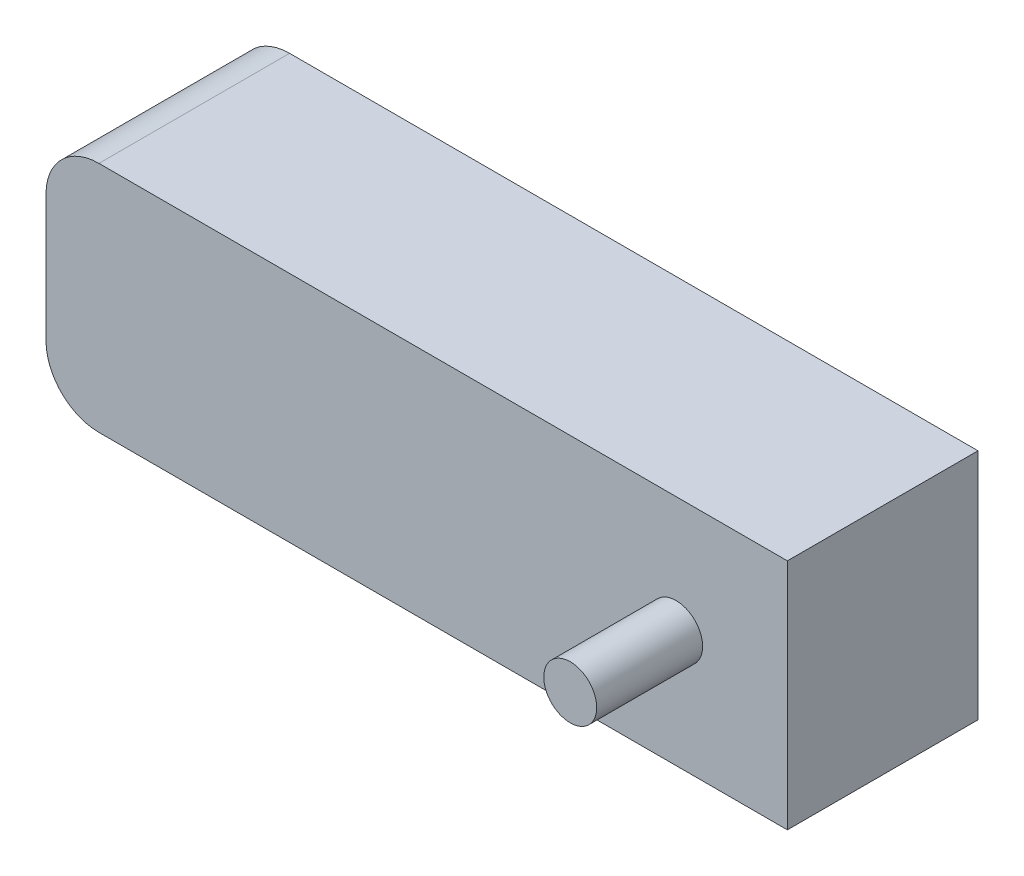
from build123d import *

# Parameters (mm, degrees)
CROQUIS1_W              = 70
CROQUIS1_H              = 22
SALIENTE_EXTRUIR1_DEPTH = 18
CROQUIS2_R              = 2.5
SALIENTE_EXTRUIR2_DEPTH = 10
REDONDEO3_R             = 5
REDONDEO4_R             = 5


with BuildPart() as part:
    # Croquis1 → Saliente-Extruir1 (new body)
    with BuildSketch(Plane.XY):
        with Locations((35, 11)):
            Rectangle(CROQUIS1_W, CROQUIS1_H)
    extrude(amount=SALIENTE_EXTRUIR1_DEPTH)

    # Croquis2 → Saliente-Extruir2 (add)
    with BuildSketch(Plane.XY.offset(18)):
        with Locations(Location((59.5, 11, 0), (0, 0, 180))):
            Circle(CROQUIS2_R)
    extrude(amount=SALIENTE_EXTRUIR2_DEPTH)

    # Redondeo3
    redondeo3_edges = [part.edges().sort_by_distance(p)[0] for p in [
        (0, 22, 9),
    ]]
    fillet(redondeo3_edges, radius=REDONDEO3_R)

    # Redondeo4
    redondeo4_edges = [part.edges().sort_by_distance(p)[0] for p in [
        (0, 0, 9),
    ]]
    fillet(redondeo4_edges, radius=REDONDEO4_R)


solid = part.part
